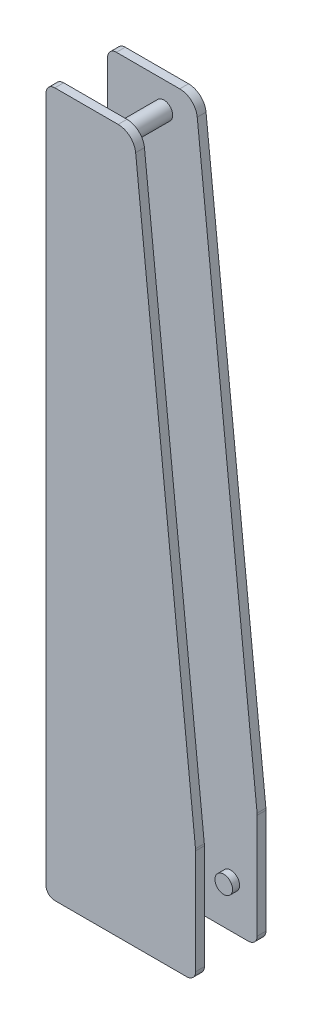
from build123d import *

# Parameters (mm, degrees)
BOSS_EXTRUDE1_DEPTH     = 5
SKETCH3_R               = 5
BOSS_EXTRUDE2_DEPTH     = 30
BOSS_EXTRUDE3_DEPTH     = 5
CUT_EXTRUDE3_DEPTH      = 11
CUT_EXTRUDE3_DEPTH_BACK = 11
SKETCH5_R               = 5


with BuildPart() as part:
    # Sketch2 → Boss-Extrude1 (new body)
    with BuildSketch(Plane.XY):
        with BuildLine():
            Line((0.936211321, 291.039120216), (34.945864928, -34.48185003))
            ThreePointArc((34.945864928, -34.48185003), (34.986457062, -35.000705547), (35, -35.520970246))
            Line((35, -35.520970246), (35, -95))
            ThreePointArc((35, -95), (33.535533906, -98.535533906), (30, -100))
            Line((30, -100), (-45, -100))
            ThreePointArc((-45, -100), (-48.535533906, -98.535533906), (-50, -95))
            Line((-50, -95), (-50, 295))
            ThreePointArc((-50, 295), (-48.535533906, 298.535533906), (-45, 300))
            Line((-45, 300), (-9.009653608, 300))
            ThreePointArc((-9.009653608, 300), (-2.316044797, 297.429374205), (0.936211321, 291.039120216))
        make_face()
    extrude(amount=BOSS_EXTRUDE1_DEPTH)

    # Sketch3 → Boss-Extrude2 (add)
    with BuildSketch(Plane.XY.offset(5)):
        with Locations(Location((-18, 285, 0), (0, 0, 180))):
            Circle(SKETCH3_R)
        with Locations(Location((20, -75, 0), (0, 0, 180))):
            Circle(SKETCH3_R)
    extrude(amount=BOSS_EXTRUDE2_DEPTH)

    # Sketch4 → Boss-Extrude3 (add)
    with BuildSketch(Plane.XY.offset(35)):
        with BuildLine():
            Line((35, -95), (35, -35.520970246))
            ThreePointArc((35, -35.520970246), (34.986457062, -35.000705547), (34.945864928, -34.48185003))
            Line((34.945864928, -34.48185003), (0.936211321, 291.039120216))
            ThreePointArc((0.936211321, 291.039120216), (-2.316044797, 297.429374205), (-9.009653608, 300))
            Line((-9.009653608, 300), (-45, 300))
            ThreePointArc((-45, 300), (-48.535533906, 298.535533906), (-50, 295))
            Line((-50, 295), (-50, -95))
            ThreePointArc((-50, -95), (-48.535533906, -98.535533906), (-45, -100))
            Line((-45, -100), (30, -100))
            ThreePointArc((30, -100), (33.535533906, -98.535533906), (35, -95))
        make_face()
    extrude(amount=BOSS_EXTRUDE3_DEPTH)

    # Sketch5 → Cut-Extrude3 (cut, two sides: drawn at the far end of the back side and taken through both)
    with BuildSketch(Plane.XY.offset(20).offset(-CUT_EXTRUDE3_DEPTH_BACK)):
        with Locations(Location((20, -75, 0), (0, 0, 180))):
            Circle(SKETCH5_R)
    extrude(amount=CUT_EXTRUDE3_DEPTH + CUT_EXTRUDE3_DEPTH_BACK, mode=Mode.SUBTRACT)


solid = part.part
